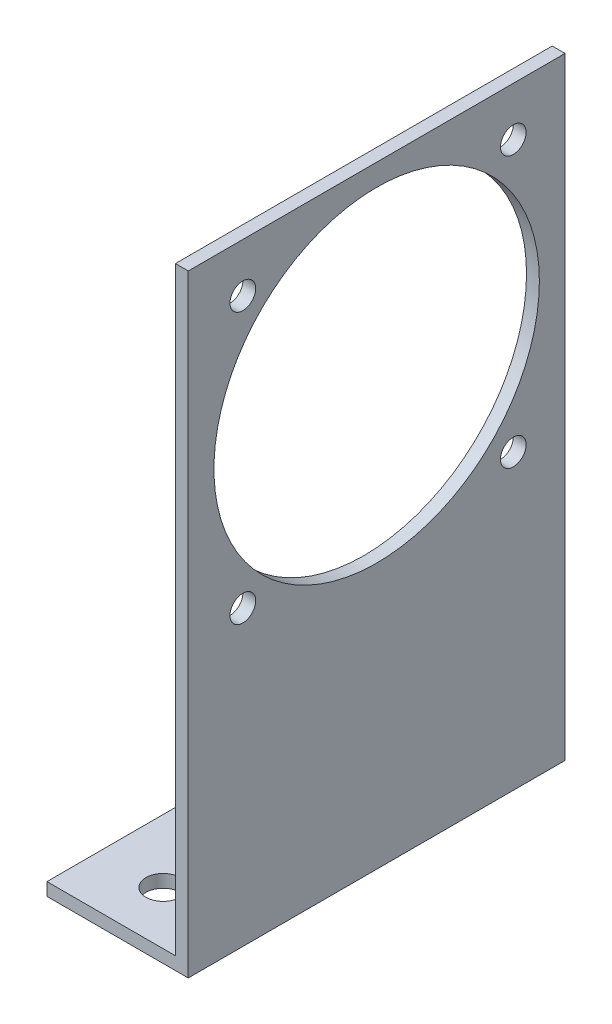
from build123d import *

# Parameters (mm, degrees)
EXTRUDE_THIN1_DEPTH = 44
SKETCH2_R           = 19
CUT_EXTRUDE1_DEPTH  = 85.310438262
SKETCH3_R           = 2
CUT_EXTRUDE2_DEPTH  = 85.310438262
SKETCH4_R           = 1.5
CUT_EXTRUDE3_DEPTH  = 85.310438262


with BuildPart() as part:
    # Sketch1 → Extrude-Thin1 (new body)
    with BuildSketch(Plane.XY):
        Polygon((0, 0), (15, 0), (15, 70), (16.5, 70), (16.5, -1.5), (0, -1.5), align=None)
    extrude(amount=EXTRUDE_THIN1_DEPTH)

    # Sketch2 → Cut-Extrude1 (cut, through all)
    with BuildSketch(Plane(origin=(16.5, 0, 0), x_dir=(0, 0, -1), z_dir=(1, 0, 0))):
        with Locations((-22, 48.459332075)):
            Circle(SKETCH2_R)
    extrude(amount=-CUT_EXTRUDE1_DEPTH, mode=Mode.SUBTRACT)

    # Sketch3 → Cut-Extrude2 (cut, through all)
    with BuildSketch(Plane(origin=(0, 0, 0), x_dir=(1, 0, 0), z_dir=(0, 1, 0))):
        with Locations(Location((7.370084174, -6.191389664, 0), (0, 0, 270))):
            Circle(SKETCH3_R)
        with Locations(Location((7.370084174, -37.808610336, 0), (0, 0, 270))):
            Circle(SKETCH3_R)
    extrude(amount=-CUT_EXTRUDE2_DEPTH, mode=Mode.SUBTRACT)

    # Sketch4 → Cut-Extrude3 (cut, through all)
    with BuildSketch(Plane(origin=(16.5, 0, 0), x_dir=(0, 0, -1), z_dir=(1, 0, 0))):
        with Locations((-37.627392524, 64.304718843)):
            Circle(SKETCH4_R)
        with Locations((-6.044034896, 64.304718843)):
            Circle(SKETCH4_R)
        with Locations((-37.627392524, 32.719245679)):
            Circle(SKETCH4_R)
        with Locations((-6.044034896, 32.719245679)):
            Circle(SKETCH4_R)
    extrude(amount=-CUT_EXTRUDE3_DEPTH, mode=Mode.SUBTRACT)


solid = part.part
